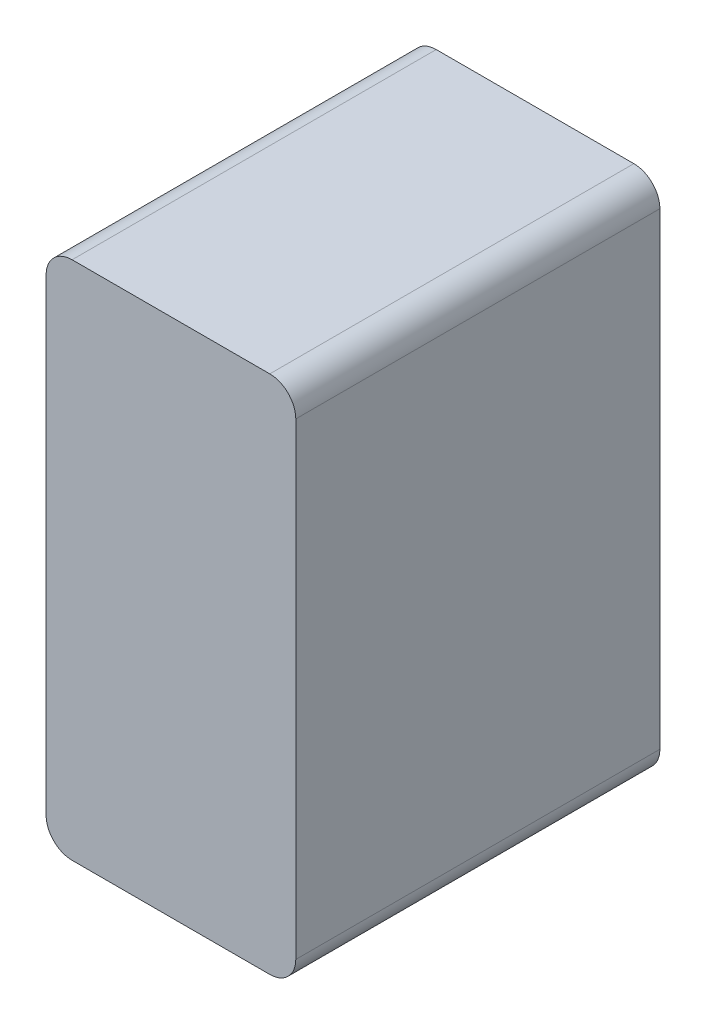
from build123d import *

# Parameters (mm, degrees)
SKETCH_1_W          = 48
SKETCH_1_H          = 100
EXTRUDE_1_DEPTH     = 70
SKETCH_2_W          = 44
SKETCH_2_H          = 96
CUT_EXTRUDE_1_DEPTH = 68
FILLET_1_R          = 5


with BuildPart() as part:
    # 草图1 → 凸台-拉伸1 (new body)
    with BuildSketch(Plane.XY):
        Rectangle(SKETCH_1_W, SKETCH_1_H)
    extrude(amount=EXTRUDE_1_DEPTH)

    # 草图2 → 切除-拉伸1 (cut)
    with BuildSketch(Plane(origin=(0, 0, 0), x_dir=(-1, 0, 0), z_dir=(0, 0, -1))):
        Rectangle(SKETCH_2_W, SKETCH_2_H)
    extrude(amount=-CUT_EXTRUDE_1_DEPTH, mode=Mode.SUBTRACT)

    # 圆角1
    fillet_1_edges = [part.edges().sort_by_distance(p)[0] for p in [
        (-22, 48, 34),
        (-22, -48, 34),
        (22, -48, 34),
        (22, 48, 34),
        (24, -50, 35),
        (-24, -50, 35),
        (-24, 50, 35),
        (24, 50, 35),
    ]]
    fillet(fillet_1_edges, radius=FILLET_1_R)


solid = part.part
